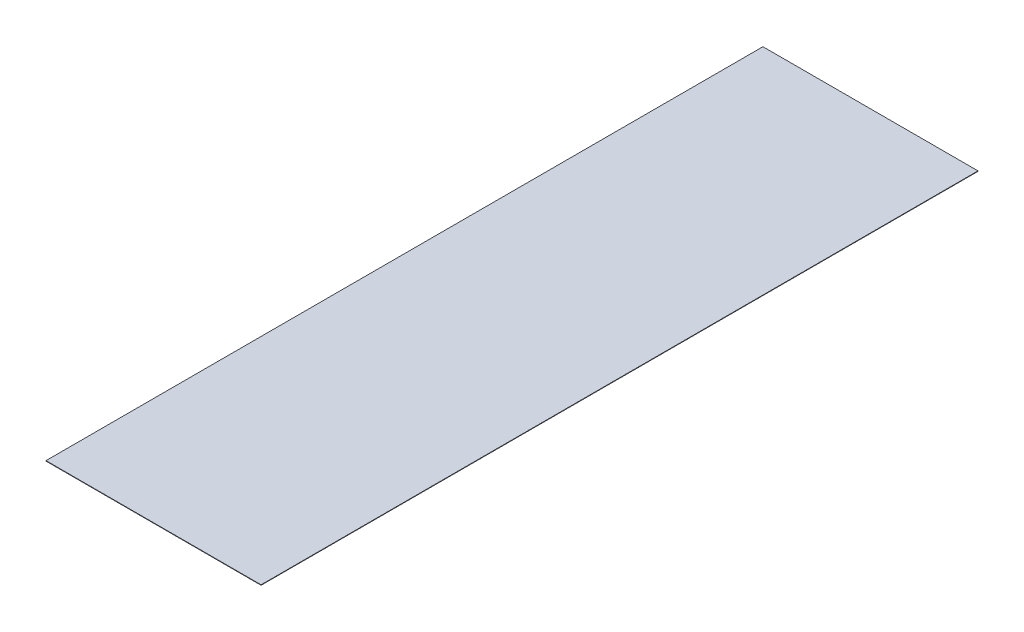
from build123d import *

# Parameters (mm, degrees)
CROQUIS1_W              = 914.4
CROQUIS1_H              = 3048
SALIENTE_EXTRUIR1_DEPTH = 1.9


with BuildPart() as part:
    # Croquis1 → Saliente-Extruir1 (new body)
    with BuildSketch(Plane(origin=(0, 0, 0), x_dir=(1, 0, 0), z_dir=(0, 1, 0))):
        Rectangle(CROQUIS1_W, CROQUIS1_H)
    extrude(amount=SALIENTE_EXTRUIR1_DEPTH)


solid = part.part
